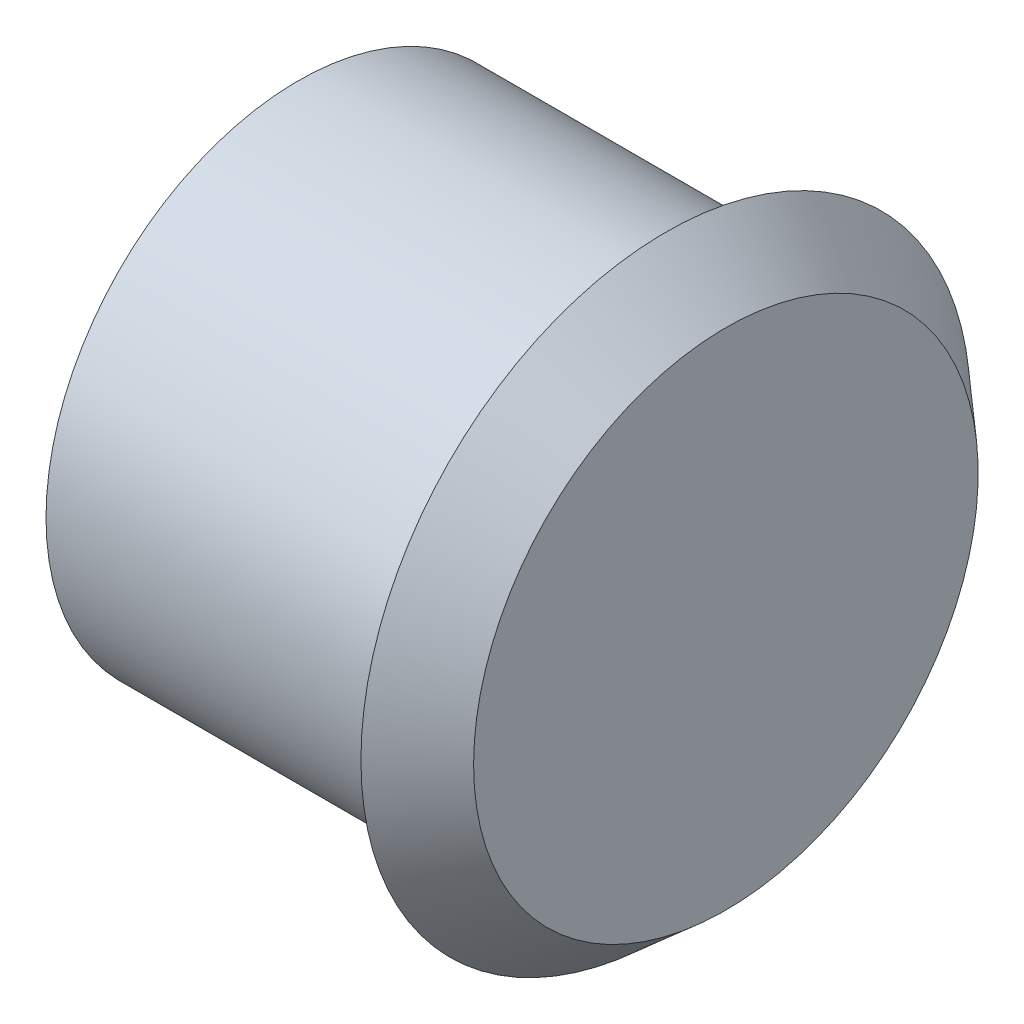
from build123d import *

# Parameters (mm, degrees)
SKETCH4_R           = 13.371322
BOSS_EXTRUDE1_DEPTH = 19.477228


with BuildPart() as part:
    # Sketch2 → Revolve1 (revolve)
    with BuildSketch(Plane(origin=(0, 0, 0), x_dir=(1, 0, 0), z_dir=(0, 1, 0))):
        Polygon((139.45743, -142.853156), (139.45743, -156.224478), (136.272016, -159.011112), (136.272016, -142.853156), align=None)
    revolve(axis=Axis((136.272016, 0, 142.853156), (1, 0, 0)))

    # Sketch4 → Boss-Extrude1 (add)
    with BuildSketch(Plane.ZY.offset(-136.272016)):
        with Locations((142.853156, 0)):
            Circle(SKETCH4_R)
    extrude(amount=BOSS_EXTRUDE1_DEPTH)


solid = part.part
